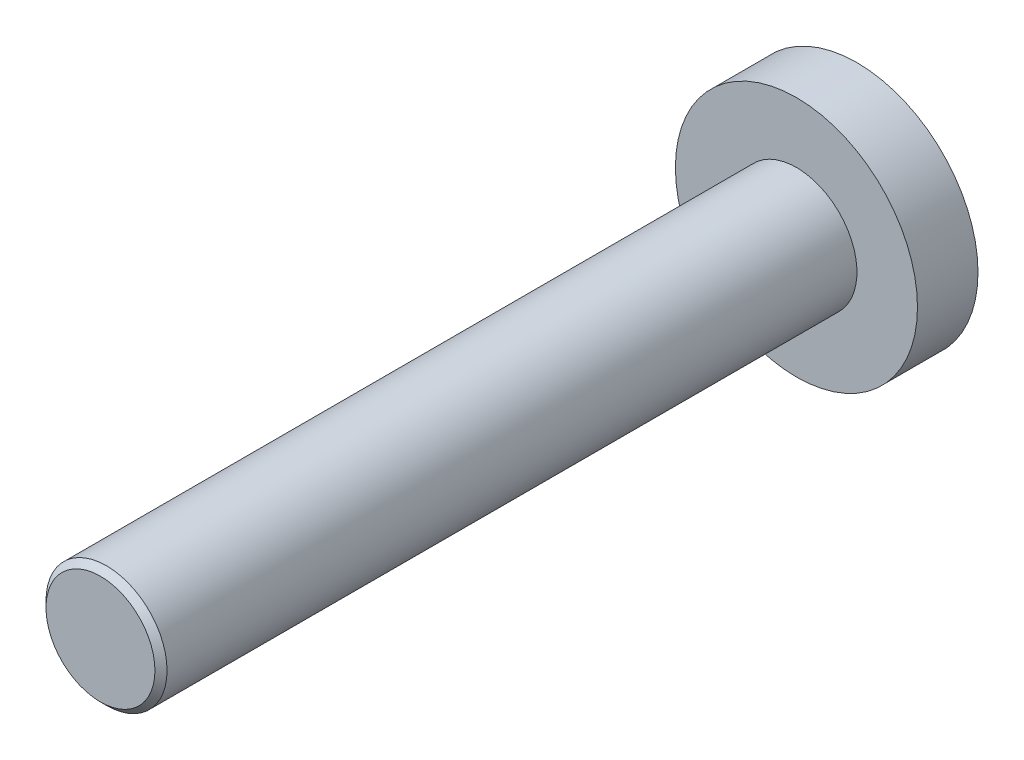
from build123d import *

# Parameters (mm, degrees)
SKETCH_1_R      = 2
EXTRUDE_1_DEPTH = 23
SKETCH_2_R      = 4
EXTRUDE_2_DEPTH = 2
CHAMFER_1_SIZE  = 0.2


with BuildPart() as part:
    # 草图1 → 拉伸1 (new body)
    with BuildSketch(Plane.XY):
        Circle(SKETCH_1_R)
    extrude(amount=EXTRUDE_1_DEPTH)

    # 草图2 → 拉伸2 (add)
    with BuildSketch(Plane(origin=(0, 0, 0), x_dir=(-1, 0, 0), z_dir=(0, 0, -1))):
        Circle(SKETCH_2_R)
    extrude(amount=EXTRUDE_2_DEPTH)

    # 倒角1
    chamfer_1_edges = [part.edges().sort_by_distance(p)[0] for p in [
        (-2, 0, 23),
    ]]
    chamfer(chamfer_1_edges, length=CHAMFER_1_SIZE)


solid = part.part
